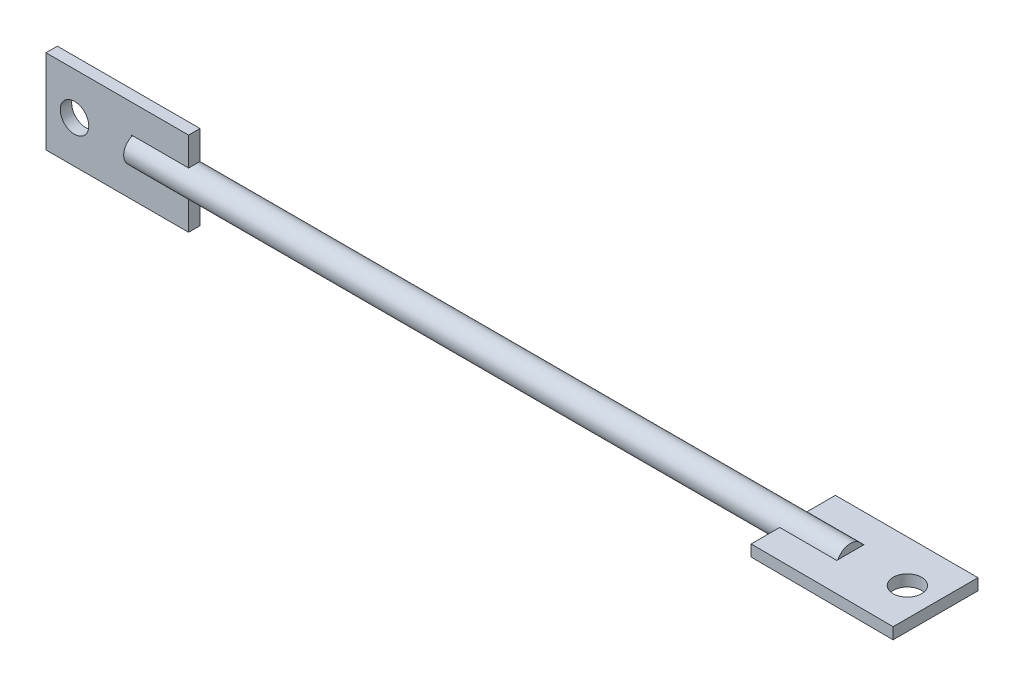
from build123d import *

# Parameters (mm, degrees)
SWEEP1_PROFILE_R    = 4.7625
SKETCH18_R          = 5
BOSS_EXTRUDE4_DEPTH = 2
SKETCH19_R          = 5
BOSS_EXTRUDE6_DEPTH = 2


with BuildPart() as part:
    # Sweep1: sweep along a path in Sketch1
    with BuildLine(Plane(origin=(0, 0, 0), x_dir=(1, 0, 0), z_dir=(0, 1, 0))) as sweep1_path:
        Line((-125, 0), (125, 0))
    # Sweep1 profile (on start of the path) → Sweep1 (sweep)
    with BuildSketch(Plane(origin=(-125, 0, 0), x_dir=(0, 0, 1), z_dir=(1, 0, 0))):
        Circle(SWEEP1_PROFILE_R)
    sweep(path=sweep1_path.line)


with BuildPart() as body_2:
    # Sketch18 → Boss-Extrude4 (new, symmetric)
    with BuildSketch(Plane.XY):
        Polygon((-125, -4.7625), (-125, 4.7625), (-105, 4.7625), (-105, 14.7625), (-155, 14.7625), (-155, -14.7625), (-105, -14.7625), (-105, -4.7625), align=None)
        with Locations((-145, 0)):
            Circle(SKETCH18_R, mode=Mode.SUBTRACT)
    extrude(amount=BOSS_EXTRUDE4_DEPTH, both=True)


with BuildPart() as body_3:
    # Sketch19 → Boss-Extrude6 (new, symmetric)
    with BuildSketch(Plane(origin=(0, 0, 0), x_dir=(1, 0, 0), z_dir=(0, 1, 0))):
        Polygon((125, -4.7625), (105, -4.7625), (105, -14.7625), (154.999441534, -14.998818204), (155, 14.7625), (105, 14.7625), (105, 4.7625), (125, 4.7625), align=None)
        with Locations(Location((144.999722982, 0, 0), (0, 0, 270))):
            Circle(SKETCH19_R, mode=Mode.SUBTRACT)
    extrude(amount=BOSS_EXTRUDE6_DEPTH, both=True)


solid = Compound([part.part, body_2.part, body_3.part])
